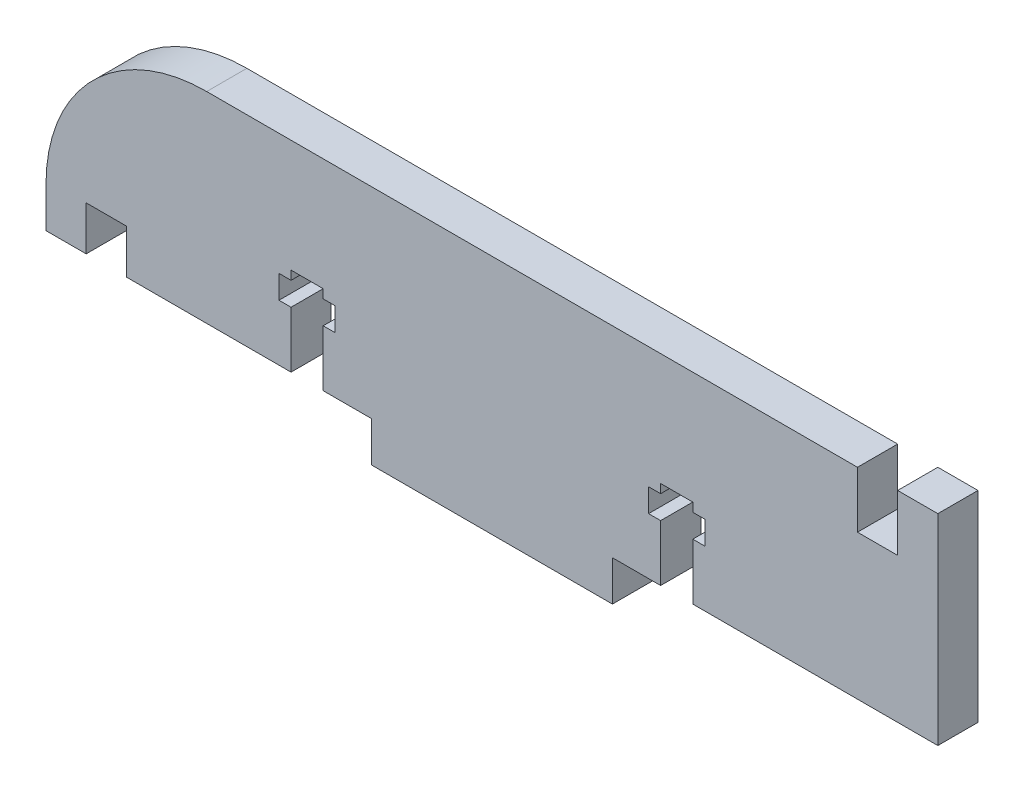
from build123d import *

# Parameters (mm, degrees)
EXTRUDE_1_DEPTH = 5
FILLET_1_R      = 20


with BuildPart() as part:
    # 草图1 → 凸台-拉伸1 (new body)
    with BuildSketch(Plane.XY):
        Polygon((-101, 0), (-80.5, 0), (-80.5, 7), (-82, 7), (-82, 9.9), (-80.5, 9.9), (-80.5, 11), (-76.5, 11), (-76.5, 9.9), (-75, 9.9), (-75, 7), (-76.5, 7), (-76.5, 0), (-70.5, 0), (-70.5, -5), (-40.5, -5), (-40.5, 0), (-34.5, 0), (-34.5, 7), (-36, 7), (-36, 9.9), (-34.5, 9.9), (-34.5, 11), (-30.5, 11), (-30.5, 9.9), (-29, 9.9), (-29, 7), (-30.5, 7), (-30.5, 0), (0, 0), (0, 25), (-5, 25), (-5, 18), (-10, 18), (-10, 25), (-111, 25), (-111, 0), (-106, 0), (-106, 5.5), (-101, 5.5), align=None)
    extrude(amount=EXTRUDE_1_DEPTH)

    # 圆角1
    fillet_1_edges = [part.edges().sort_by_distance(p)[0] for p in [
        (-111, 25, 2.5),
    ]]
    fillet(fillet_1_edges, radius=FILLET_1_R)


solid = part.part
